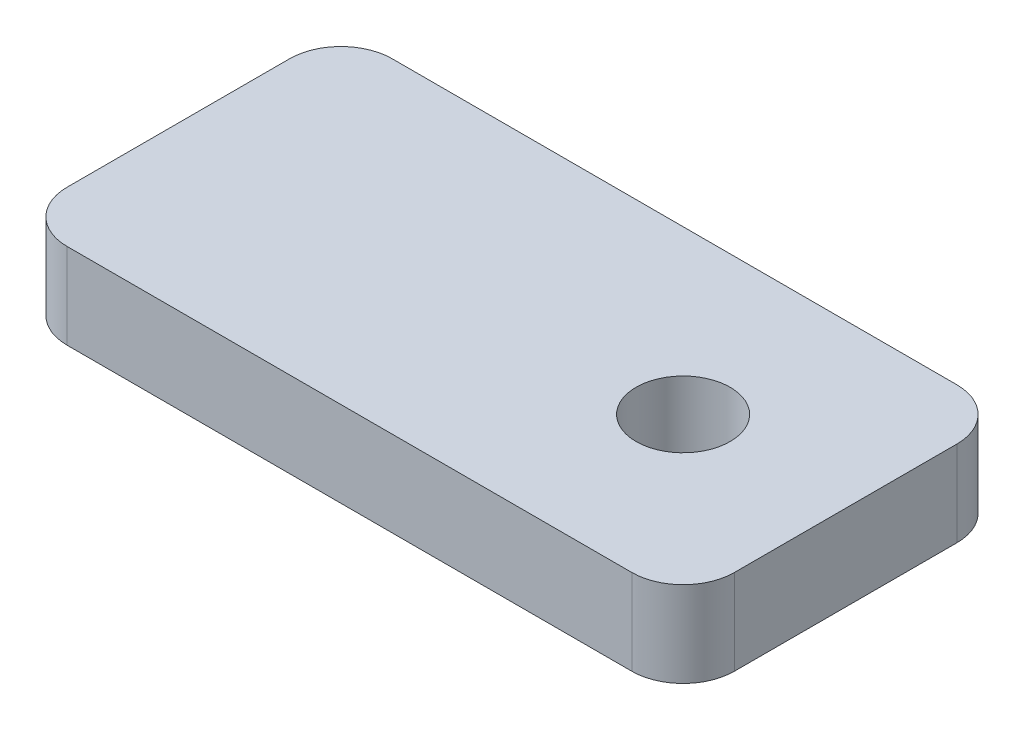
from build123d import *

# Parameters (mm, degrees)
PROFILE_DEPTH = 5
M5_HOLE_D     = 5.5


with BuildPart() as part:
    # Profile Sketch → Profile (new body)
    with BuildSketch(Plane(origin=(0, 0, 0), x_dir=(1, 0, 0), z_dir=(0, 1, 0))):
        with BuildLine():
            Line((-16.5, -9.5), (16.5, -9.5))
            ThreePointArc((16.5, -9.5), (18.621320344, -8.621320344), (19.5, -6.5))
            Line((19.5, -6.5), (19.5, 6.5))
            ThreePointArc((19.5, 6.5), (18.621320344, 8.621320344), (16.5, 9.5))
            Line((16.5, 9.5), (-16.5, 9.5))
            ThreePointArc((-16.5, 9.5), (-18.621320344, 8.621320344), (-19.5, 6.5))
            Line((-19.5, 6.5), (-19.5, -6.5))
            ThreePointArc((-19.5, -6.5), (-18.621320344, -8.621320344), (-16.5, -9.5))
        make_face()
    extrude(amount=-PROFILE_DEPTH)

    # M5 Hole (through all)
    with Locations(Plane(origin=(0, 0, 0), x_dir=(1, 0, 0), z_dir=(0, 1, 0))):
        with Locations((10, 0)):
            Hole(M5_HOLE_D / 2)


solid = part.part
